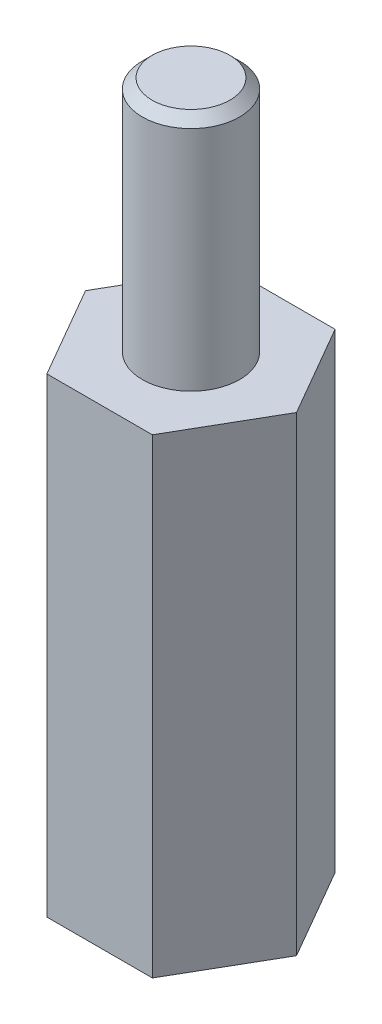
from build123d import *

# Parameters (mm, degrees)
BOSS_EXTRUDE1_DEPTH = 12.1
SKETCH2_R           = 1.25
BOSS_EXTRUDE2_DEPTH = 6.1
CHAMFER1_SIZE       = 0.25
SKETCH3_R           = 1.25
CUT_EXTRUDE1_DEPTH  = 10


with BuildPart() as part:
    # Sketch1 → Boss-Extrude1 (new body)
    with BuildSketch(Plane(origin=(0, 0, 0), x_dir=(1, 0, 0), z_dir=(0, 1, 0))):
        Polygon((2.713546265, 0), (1.356773133, 2.35), (-1.356773133, 2.35), (-2.713546265, 0), (-1.356773133, -2.35), (1.356773133, -2.35), align=None)
    extrude(amount=BOSS_EXTRUDE1_DEPTH)

    # Sketch2 → Boss-Extrude2 (add)
    with BuildSketch(Plane(origin=(0, 12.1, 0), x_dir=(1, 0, 0), z_dir=(0, 1, 0))):
        with Locations(Location((0, 0, 0), (0, 0, 270))):
            Circle(SKETCH2_R)
    extrude(amount=BOSS_EXTRUDE2_DEPTH)

    # Chamfer1
    chamfer1_edges = [part.edges().sort_by_distance(p)[0] for p in [
        (0, 18.2, -1.25),
    ]]
    chamfer(chamfer1_edges, length=CHAMFER1_SIZE)

    # Sketch3 → Cut-Extrude1 (cut)
    with BuildSketch(Plane.XZ):
        with Locations(Location((0, 0, 0), (0, 0, 90))):
            Circle(SKETCH3_R)
    extrude(amount=-CUT_EXTRUDE1_DEPTH, mode=Mode.SUBTRACT)


solid = part.part
